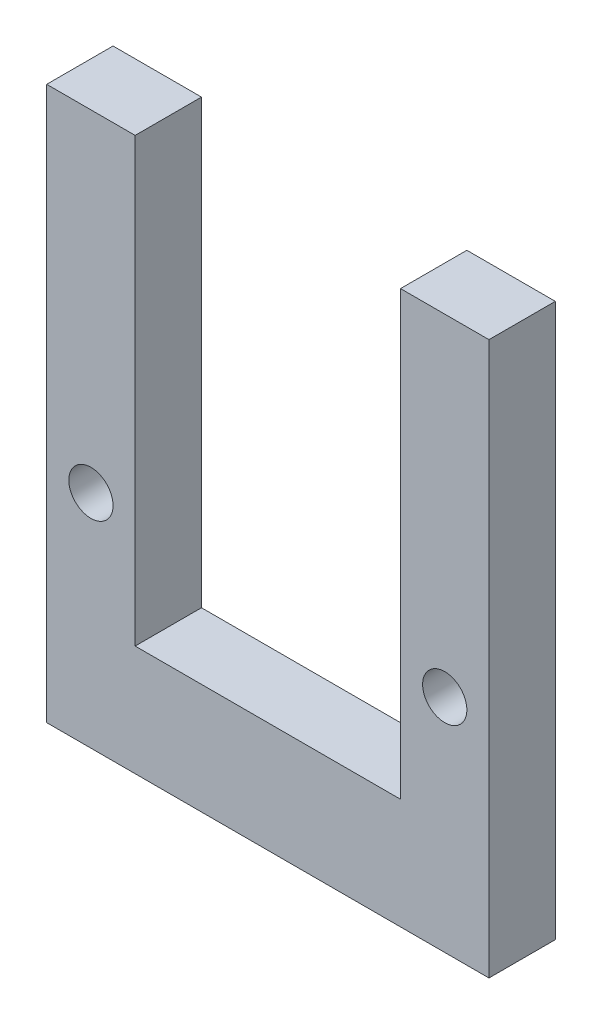
from build123d import *

# Parameters (mm, degrees)
SKETCH3_R           = 1
BOSS_EXTRUDE1_DEPTH = 1.5


with BuildPart() as part:
    # Sketch3 → Boss-Extrude1 (new, symmetric)
    with BuildSketch(Plane.XY):
        Polygon((-6, -7.5), (-6, 12.5), (-10, 12.5), (-10, -12.5), (10, -12.5), (10, 12.5), (6, 12.5), (6, -7.5), align=None)
        with Locations((-8, -2.5)):
            Circle(SKETCH3_R, mode=Mode.SUBTRACT)
        with Locations(Location((8, -2.5, 0), (0, 0, 180))):
            Circle(SKETCH3_R, mode=Mode.SUBTRACT)
    extrude(amount=BOSS_EXTRUDE1_DEPTH, both=True)


solid = part.part
